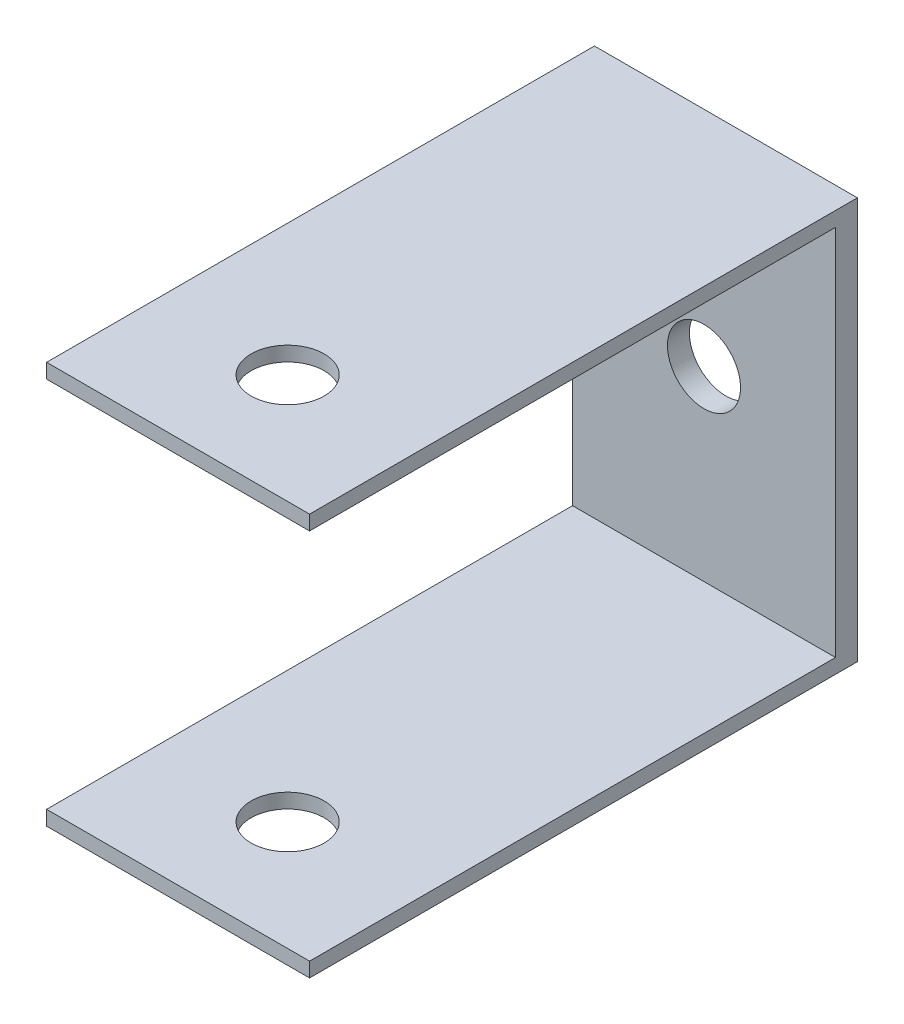
from build123d import *

# Parameters (mm, degrees)
ESBO_O1_W                = 36
ESBO_O1_H                = 55
RESSALTO_EXTRUS_O1_DEPTH = 75
ESBO_O2_W                = 34
ESBO_O2_H                = 30
CORTE_EXTRUS_O1_DEPTH    = 56
ESBO_O3_W                = 56
ESBO_O3_H                = 51
CORTE_EXTRUS_O2_DEPTH    = 57
ESBO_O5_R                = 5
CORTE_EXTRUS_O4_DEPTH    = 57
ESBO_O6_W                = 36
ESBO_O6_H                = 51
CORTE_EXTRUS_O5_DEPTH    = 16
ESBO_O4_R                = 5
CORTE_EXTRUS_O6_DEPTH    = 63


with BuildPart() as part:
    # Esboço1 → Ressalto-extrusão1 (new body)
    with BuildSketch(Plane.XY):
        Rectangle(ESBO_O1_W, ESBO_O1_H)
    extrude(amount=RESSALTO_EXTRUS_O1_DEPTH)

    # Esboço2 → Corte-extrusão1 (cut)
    with BuildSketch(Plane.XY.offset(75)):
        Rectangle(ESBO_O2_W, ESBO_O2_H)
    extrude(amount=-CORTE_EXTRUS_O1_DEPTH, mode=Mode.SUBTRACT)

    # Esboço3 → Corte-extrusão2 (cut)
    with BuildSketch(Plane.ZY.offset(18)):
        with Locations((47, 0)):
            Rectangle(ESBO_O3_W, ESBO_O3_H)
    extrude(amount=-CORTE_EXTRUS_O2_DEPTH, mode=Mode.SUBTRACT)

    # Esboço5 → Corte-extrusão4 (cut)
    with BuildSketch(Plane(origin=(0, 0, 0), x_dir=(-1, 0, 0), z_dir=(0, 0, -1))):
        Circle(ESBO_O5_R)
    extrude(amount=-CORTE_EXTRUS_O4_DEPTH, mode=Mode.SUBTRACT)

    # Esboço6 → Corte-extrusão5 (cut)
    with BuildSketch(Plane.XY.offset(19)):
        Rectangle(ESBO_O6_W, ESBO_O6_H)
    extrude(amount=-CORTE_EXTRUS_O5_DEPTH, mode=Mode.SUBTRACT)

    # Esboço4 → Corte-extrusão6 (cut)
    with BuildSketch(Plane.XZ.offset(27.5)):
        with Locations((0, 60)):
            Circle(ESBO_O4_R)
    extrude(amount=-CORTE_EXTRUS_O6_DEPTH, mode=Mode.SUBTRACT)


solid = part.part
